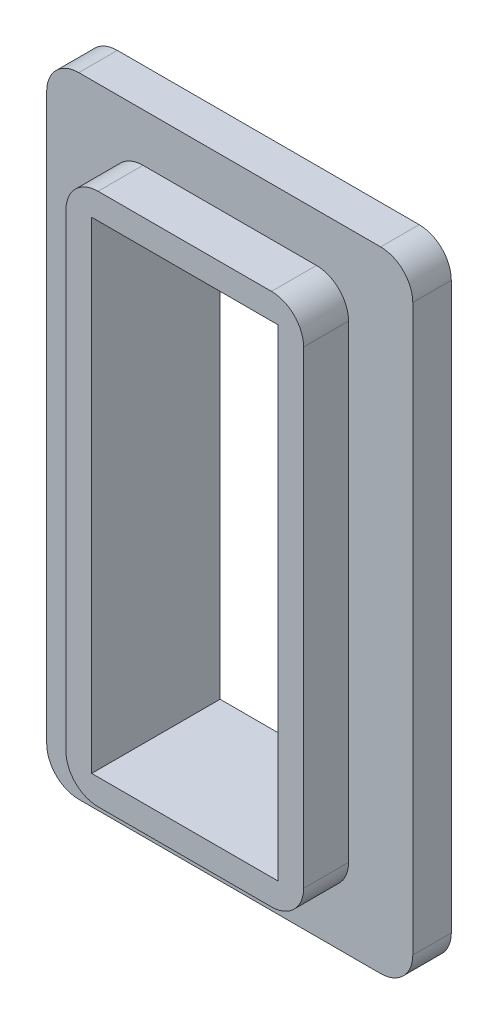
from build123d import *

# Parameters (mm, degrees)
BOSS_EXTRUDE1_DEPTH      = 0.6
BOSS_EXTRUDE1_DEPTH_BACK = 0.6
SKETCH1_W                = 11.4
SKETCH1_H                = 19.6
BOSS_EXTRUDE2_DEPTH      = 2
BOSS_EXTRUDE2_DEPTH_BACK = 2
SKETCH1_3_W              = 7.4
SKETCH1_3_H              = 16.6
SKETCH1_3_W_2            = 5.8
SKETCH1_3_H_2            = 15
CUT_EXTRUDE1_DEPTH       = 12.512167476
CUT_EXTRUDE1_DEPTH_BACK  = 12.512167476
SKETCH1_4_W              = 5.8
SKETCH1_4_H              = 15
FILLET1_R                = 1


with BuildPart() as part:
    # Sketch1 → Boss-Extrude1 (new, two sides: drawn at the far end of the back side and taken through both)
    with BuildSketch(Plane.XY.offset(-BOSS_EXTRUDE1_DEPTH_BACK)):
        Rectangle(SKETCH1_W, SKETCH1_H)
    extrude(amount=BOSS_EXTRUDE1_DEPTH + BOSS_EXTRUDE1_DEPTH_BACK)

    # Sketch1<3> → Boss-Extrude2 (add, two sides: drawn at the far end of the back side and taken through both)
    with BuildSketch(Plane.XY.offset(-BOSS_EXTRUDE2_DEPTH_BACK)):
        Rectangle(SKETCH1_3_W, SKETCH1_3_H)
        Rectangle(SKETCH1_3_W_2, SKETCH1_3_H_2, mode=Mode.SUBTRACT)
    extrude(amount=BOSS_EXTRUDE2_DEPTH + BOSS_EXTRUDE2_DEPTH_BACK)

    # Sketch1<4> → Cut-Extrude1 (cut, two sides: drawn at the far end of the back side and taken through both)
    with BuildSketch(Plane.XY.offset(-CUT_EXTRUDE1_DEPTH_BACK)):
        Rectangle(SKETCH1_4_W, SKETCH1_4_H)
    extrude(amount=CUT_EXTRUDE1_DEPTH + CUT_EXTRUDE1_DEPTH_BACK, mode=Mode.SUBTRACT)

    # Fillet1
    fillet1_edges = [part.edges().sort_by_distance(p)[0] for p in [
        (-3.7, 8.3, -1.3),
        (3.7, 8.3, -1.3),
        (3.7, -8.3, -1.3),
        (-3.7, -8.3, -1.3),
        (-5.7, -9.8, 0),
        (5.7, -9.8, 0),
        (3.7, -8.3, 1.3),
        (-3.7, -8.3, 1.3),
        (-3.7, 8.3, 1.3),
        (3.7, 8.3, 1.3),
        (5.7, 9.8, 0),
        (-5.7, 9.8, 0),
    ]]
    fillet(fillet1_edges, radius=FILLET1_R)


solid = part.part
